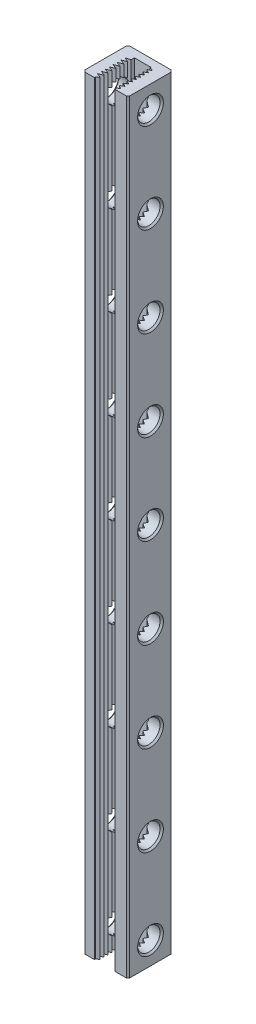
from build123d import *

# Parameters (mm, degrees)
SKETCH1_W                  = 8
SKETCH1_H                  = 8
BOSS_EXTRUDE1_DEPTH        = 300
CUT_EXTRUDE1_DEPTH         = 301.213257535
SKETCH3_R                  = 2
CUT_EXTRUDE2_DEPTH         = 301.213257535
CHAMFER1_SIZE              = 0.3
CHAMFER2_SIZE              = 0.3
LPATTERN1_COUNT            = 19
LPATTERN1_PITCH            = 16
CHAMFER1_OF_LPATTERN1_SIZE = 0.3
SKETCH4_W                  = 8
SKETCH4_H                  = 164
CUT_EXTRUDE3_DEPTH         = 301.213257535


with BuildPart() as part:
    # Sketch1 → Boss-Extrude1 (new body)
    with BuildSketch(Plane(origin=(0, 0, 0), x_dir=(1, 0, 0), z_dir=(0, 1, 0))):
        with Locations((4, 4)):
            Rectangle(SKETCH1_W, SKETCH1_H)
    extrude(amount=BOSS_EXTRUDE1_DEPTH)

    # Sketch2 → Cut-Extrude1 (cut, through all)
    with BuildSketch(Plane.XZ):
        Polygon((5.652029979, 0), (2.008445554, 0), (2.008445554, -0.208206305), (2.54, -0.515099407), (1.673719601, -0.865099407), (2.54, -1.215099407), (1.673719601, -1.572712655), (2.54, -1.915099407), (1.673719601, -2.265099407), (2.54, -2.615099407), (1.673719601, -2.965099407), (2.54, -3.315099407), (1.673719601, -3.665099407), (2.54, -4.015099407), (1.673719601, -4.365099407), (2.54, -4.715099407), (1.673719601, -5.065099407), (2.54, -5.415099407), (1.673719601, -5.765099407), (2.54, -6.026380467), (2.54, -6.6), (5.46, -6.6), (5.46, -6.49878106), (6.106693316, -6.2375), (5.46, -5.8875), (6.106693316, -5.5375), (5.46, -5.1875), (6.106693316, -4.8375), (5.46, -4.4875), (6.106693316, -4.1375), (5.46, -3.7875), (6.106693316, -3.4375), (5.46, -3.0875), (6.106693316, -2.7375), (5.46, -2.3875), (6.106693316, -2.0375), (5.46, -1.6875), (6.106693316, -1.345113247), (5.46, -0.9875), (6.106693316, -0.6375), (5.652029979, -0.375), align=None)
    extrude(amount=-CUT_EXTRUDE1_DEPTH, mode=Mode.SUBTRACT)

    # Sketch3 → Cut-Extrude2 (cut, through all)
    with BuildSketch(Plane(origin=(8, 0, 0), x_dir=(0, 0, -1), z_dir=(1, 0, 0))):
        with Locations((4, 4)):
            Circle(SKETCH3_R)
    cut_extrude2 = extrude(amount=-CUT_EXTRUDE2_DEPTH, mode=Mode.SUBTRACT)

    # Chamfer1
    chamfer1_edges = [part.edges().sort_by_distance(p)[0] for p in [
        (0, 4, -2),
        (8, 4, -2),
    ]]
    chamfer(chamfer1_edges, length=CHAMFER1_SIZE)

    # Chamfer2
    chamfer2_edges = [part.edges().sort_by_distance(p)[0] for p in [
        (0, 150, -8),
        (8, 150, -8),
        (8, 150, 0),
        (0, 150, 0),
    ]]
    chamfer(chamfer2_edges, length=CHAMFER2_SIZE)

    # LPattern1: Cut-Extrude2 ×19
    with Locations(*[(0, i * LPATTERN1_PITCH, 0) for i in range(1, LPATTERN1_COUNT)]):
        add(cut_extrude2, mode=Mode.SUBTRACT)

    # Chamfer1 of LPattern1
    chamfer1_of_lpattern1_edges = [part.edges().sort_by_distance(p)[0] for p in [
        (0, 20, -2),
        (8, 20, -2),
        (0, 36, -2),
        (8, 36, -2),
        (0, 52, -2),
        (8, 52, -2),
        (0, 68, -2),
        (8, 68, -2),
        (0, 84, -2),
        (8, 84, -2),
        (0, 100, -2),
        (8, 100, -2),
        (0, 116, -2),
        (8, 116, -2),
        (0, 132, -2),
        (8, 132, -2),
        (0, 148, -2),
        (8, 148, -2),
        (0, 164, -2),
        (8, 164, -2),
        (0, 180, -2),
        (8, 180, -2),
        (0, 196, -2),
        (8, 196, -2),
        (0, 212, -2),
        (8, 212, -2),
        (0, 228, -2),
        (8, 228, -2),
        (0, 244, -2),
        (8, 244, -2),
        (0, 260, -2),
        (8, 260, -2),
        (0, 276, -2),
        (8, 276, -2),
        (0, 292, -2),
        (8, 292, -2),
    ]]
    chamfer(chamfer1_of_lpattern1_edges, length=CHAMFER1_OF_LPATTERN1_SIZE)

    # Sketch4 → Cut-Extrude3 (cut, through all)
    with BuildSketch(Plane(origin=(8, 0, 0), x_dir=(0, 0, -1), z_dir=(1, 0, 0))):
        with Locations((4, 218)):
            Rectangle(SKETCH4_W, SKETCH4_H)
    extrude(amount=-CUT_EXTRUDE3_DEPTH, mode=Mode.SUBTRACT)


solid = part.part
